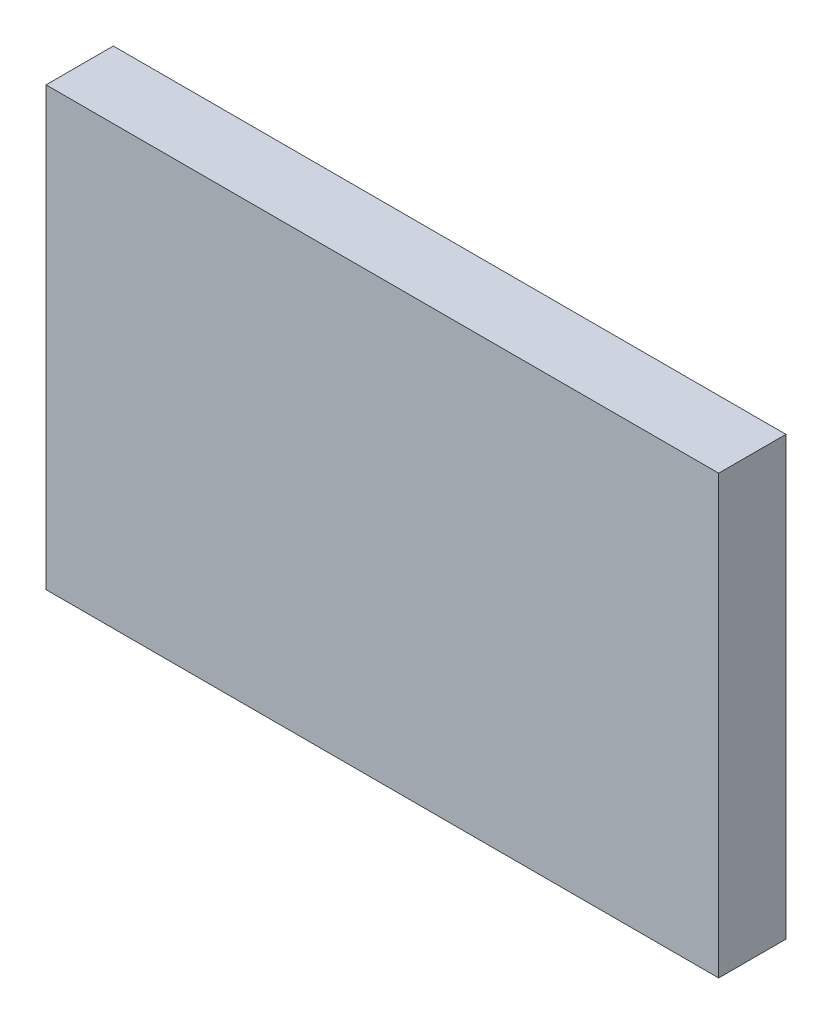
from build123d import *

# Parameters (mm, degrees)
SKETCH1_W           = 20
SKETCH1_H           = 13
BOSS_EXTRUDE1_DEPTH = 9
SKETCH2_W           = 16
SKETCH2_H           = 9
CUT_EXTRUDE1_DEPTH  = 7
SKETCH3_R           = 1.5
CUT_EXTRUDE2_DEPTH  = 7
SKETCH5_W           = 20
SKETCH5_H           = 13
CUT_EXTRUDE4_DEPTH  = 7


with BuildPart() as part:
    # Sketch1 → Boss-Extrude1 (new body)
    with BuildSketch(Plane.XY):
        with Locations((10, 6.5)):
            Rectangle(SKETCH1_W, SKETCH1_H)
    extrude(amount=BOSS_EXTRUDE1_DEPTH)

    # Sketch2 → Cut-Extrude1 (cut)
    with BuildSketch(Plane.XY.offset(9)):
        with Locations((10, 6.5)):
            Rectangle(SKETCH2_W, SKETCH2_H)
    extrude(amount=-CUT_EXTRUDE1_DEPTH, mode=Mode.SUBTRACT)

    # Sketch3 → Cut-Extrude2 (cut)
    with BuildSketch(Plane.XZ):
        with Locations(Location((3.5, 3.5, 0), (0, 0, 270))):
            Circle(SKETCH3_R)
        with Locations(Location((10, 3.5, 0), (0, 0, 270))):
            Circle(SKETCH3_R)
        with Locations(Location((16.5, 3.5, 0), (0, 0, 270))):
            Circle(SKETCH3_R)
    extrude(amount=-CUT_EXTRUDE2_DEPTH, mode=Mode.SUBTRACT)

    # Sketch5 → Cut-Extrude4 (cut)
    with BuildSketch(Plane.XY.offset(9)):
        with Locations((10, 6.5)):
            Rectangle(SKETCH5_W, SKETCH5_H)
    extrude(amount=-CUT_EXTRUDE4_DEPTH, mode=Mode.SUBTRACT)


solid = part.part
